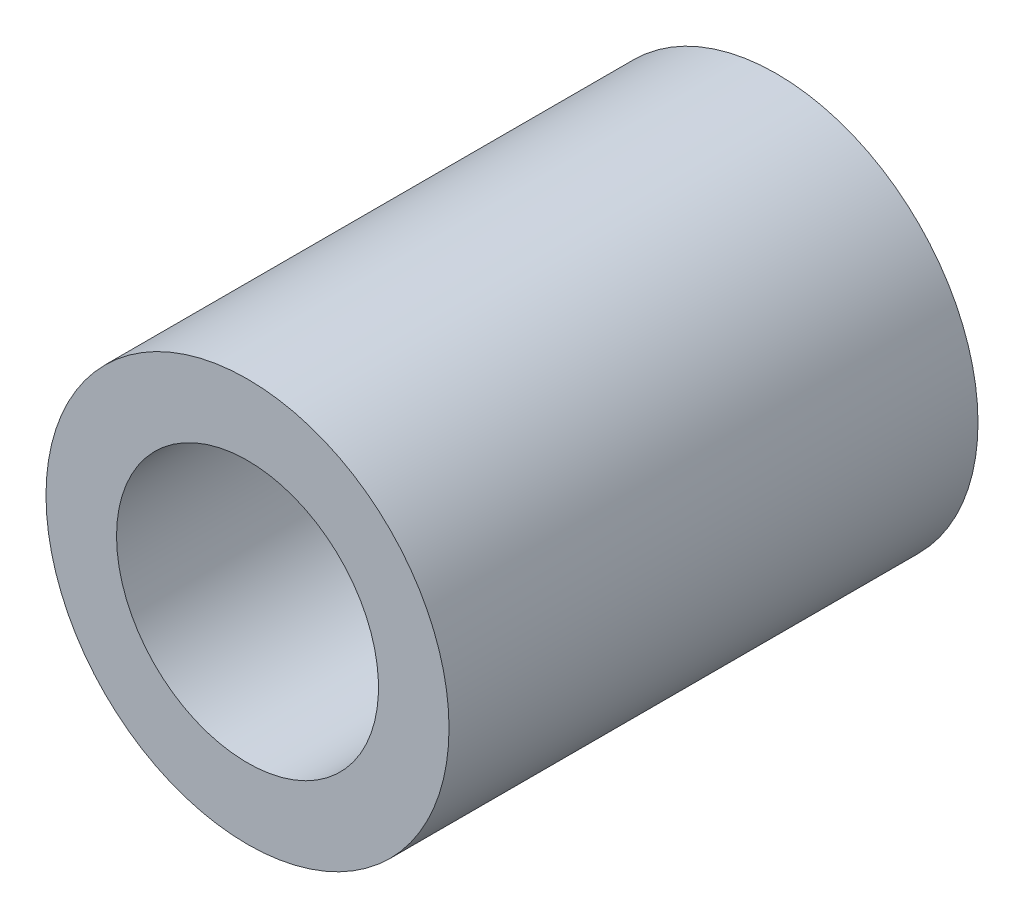
from build123d import *

# Parameters (mm, degrees)
SKETCH_1_R      = 4
SKETCH_1_R_2    = 2.6
EXTRUDE_1_DEPTH = 10.5


with BuildPart() as part:
    # 草图1 → 凸台-拉伸1 (new body)
    with BuildSketch(Plane.XY):
        with Locations(Location((0, 0, 0), (0, 0, 180))):
            Circle(SKETCH_1_R)
        with Locations(Location((0, 0, 0), (0, 0, 180))):
            Circle(SKETCH_1_R_2, mode=Mode.SUBTRACT)
    extrude(amount=EXTRUDE_1_DEPTH)


solid = part.part
